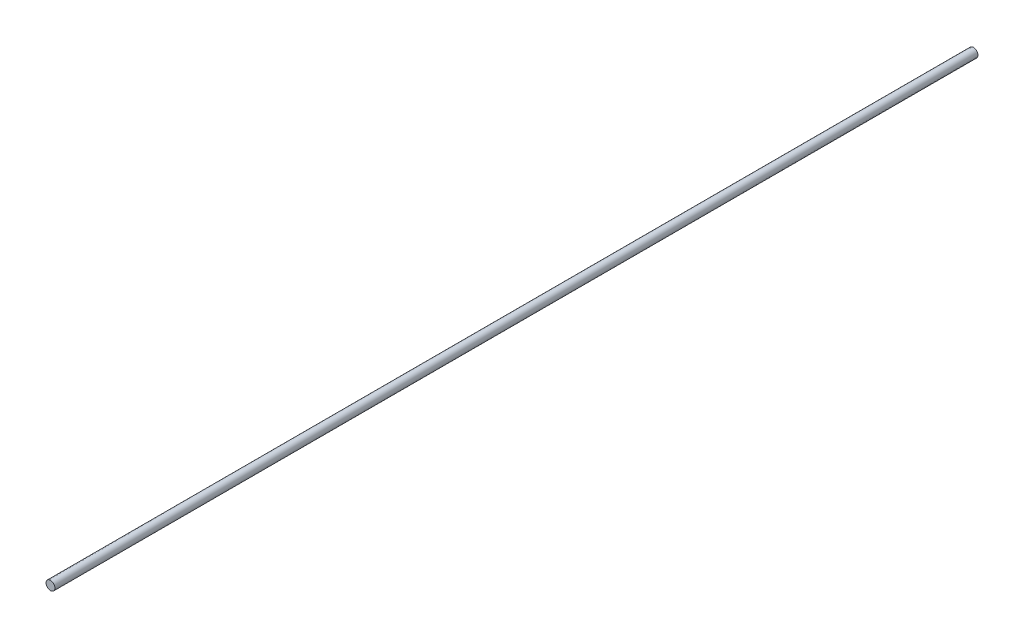
from build123d import *

# Parameters (mm, degrees)
CROQUIS1_R              = 2.95
SALIENTE_EXTRUIR1_DEPTH = 609


with BuildPart() as part:
    # Croquis1 → Saliente-Extruir1 (new body)
    with BuildSketch(Plane.XY):
        Circle(CROQUIS1_R)
    extrude(amount=-SALIENTE_EXTRUIR1_DEPTH)


solid = part.part
